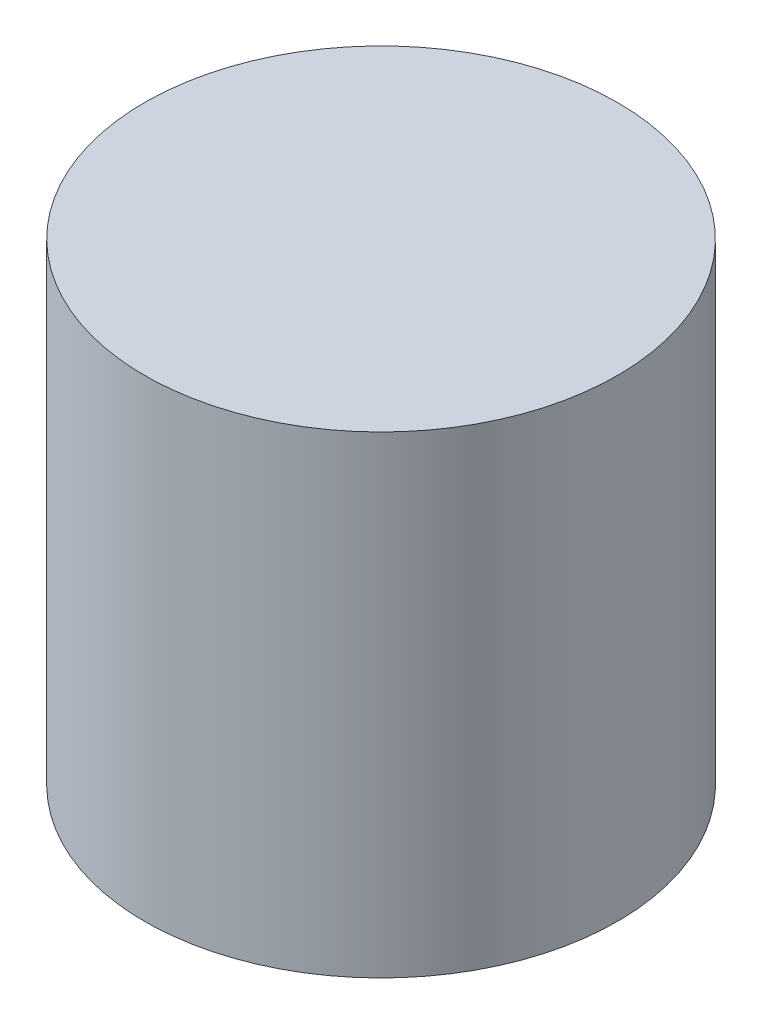
from build123d import *

# Parameters (mm, degrees)
SKETCH_1_R      = 50
EXTRUDE_1_DEPTH = 100


with BuildPart() as part:
    # 草图1 → 凸台-拉伸1 (new body)
    with BuildSketch(Plane(origin=(0, 0, 0), x_dir=(1, 0, 0), z_dir=(0, 1, 0))):
        with Locations(Location((0, 0, 0), (0, 0, 90))):
            Circle(SKETCH_1_R)
    extrude(amount=EXTRUDE_1_DEPTH)


solid = part.part
